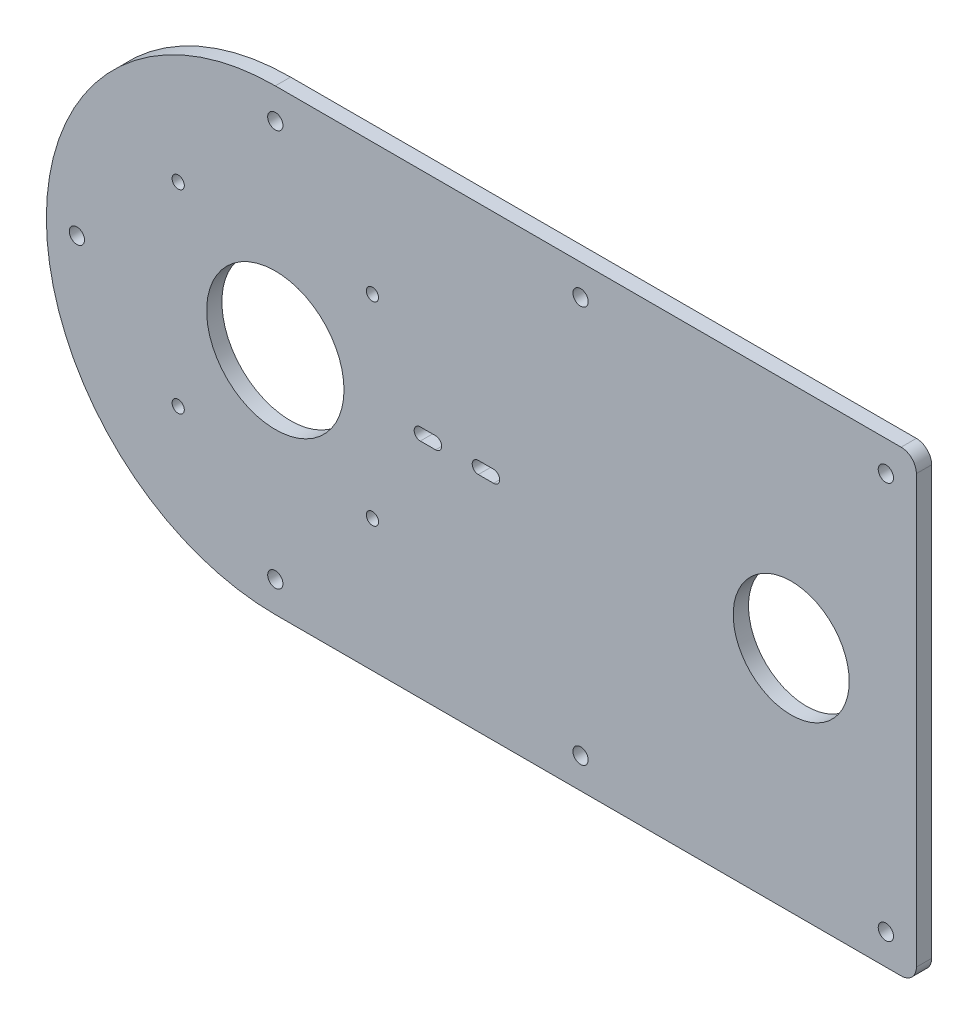
from build123d import *

# Parameters (mm, degrees)
SKETCH1_R           = 2.5
SKETCH1_R_2         = 19
SKETCH1_R_3         = 22.5
SKETCH1_R_4         = 2
BOSS_EXTRUDE1_DEPTH = 5


with BuildPart() as part:
    # Sketch1 → Boss-Extrude1 (new body)
    with BuildSketch(Plane.XY):
        with BuildLine():
            Line((30.000692042, 92.545526446), (235.000692042, 92.545526446))
            ThreePointArc((235.000692042, 92.545526446), (238.536225947, 91.081060352), (240.000692042, 87.545526446))
            Line((240.000692042, 87.545526446), (240.000692042, -52.454473554))
            ThreePointArc((240.000692042, -52.454473554), (238.536225947, -55.99000746), (235.000692042, -57.454473554))
            Line((235.000692042, -57.454473554), (30.000692042, -57.454473554))
            ThreePointArc((30.000692042, -57.454473554), (-44.999307958, 17.545526446), (30.000692042, 92.545526446))
        make_face()
        with Locations((-34.999307958, 17.545526446)):
            Circle(SKETCH1_R, mode=Mode.SUBTRACT)
        with Locations((30.000692042, -47.454473554)):
            Circle(SKETCH1_R, mode=Mode.SUBTRACT)
        with Locations((30.000692042, 82.545526446)):
            Circle(SKETCH1_R, mode=Mode.SUBTRACT)
        with Locations((230.000692042, -47.454473554)):
            Circle(SKETCH1_R, mode=Mode.SUBTRACT)
        with Locations((230.000692042, 82.545526446)):
            Circle(SKETCH1_R, mode=Mode.SUBTRACT)
        with Locations((130.000692042, 82.545526446)):
            Circle(SKETCH1_R, mode=Mode.SUBTRACT)
        with Locations((130.000692042, -47.454473554)):
            Circle(SKETCH1_R, mode=Mode.SUBTRACT)
        with Locations((199.000692042, 17.545526446)):
            Circle(SKETCH1_R_2, mode=Mode.SUBTRACT)
        with Locations((30.000692042, 17.545526446)):
            Circle(SKETCH1_R_3, mode=Mode.SUBTRACT)
        with Locations((61.815692042, 49.360526446)):
            Circle(SKETCH1_R_4, mode=Mode.SUBTRACT)
        with Locations((61.815692042, -14.269473554)):
            Circle(SKETCH1_R_4, mode=Mode.SUBTRACT)
        with Locations((-1.814307958, -14.269473554)):
            Circle(SKETCH1_R_4, mode=Mode.SUBTRACT)
        with Locations((-1.814307958, 49.360526446)):
            Circle(SKETCH1_R_4, mode=Mode.SUBTRACT)
        with BuildLine():
            Line((77.500692042, 19.545526446), (82.500692042, 19.545526446))
            ThreePointArc((82.500692042, 19.545526446), (84.500692042, 17.545526446), (82.500692042, 15.545526446))
            Line((82.500692042, 15.545526446), (77.500692042, 15.545526446))
            ThreePointArc((77.500692042, 15.545526446), (75.500692042, 17.545526446), (77.500692042, 19.545526446))
        make_face(mode=Mode.SUBTRACT)
        with BuildLine():
            Line((101.500692042, 19.545526446), (96.500692042, 19.545526446))
            ThreePointArc((96.500692042, 19.545526446), (94.500692042, 17.545526446), (96.500692042, 15.545526446))
            Line((96.500692042, 15.545526446), (101.500692042, 15.545526446))
            ThreePointArc((101.500692042, 15.545526446), (103.500692042, 17.545526446), (101.500692042, 19.545526446))
        make_face(mode=Mode.SUBTRACT)
    extrude(amount=BOSS_EXTRUDE1_DEPTH)


solid = part.part
